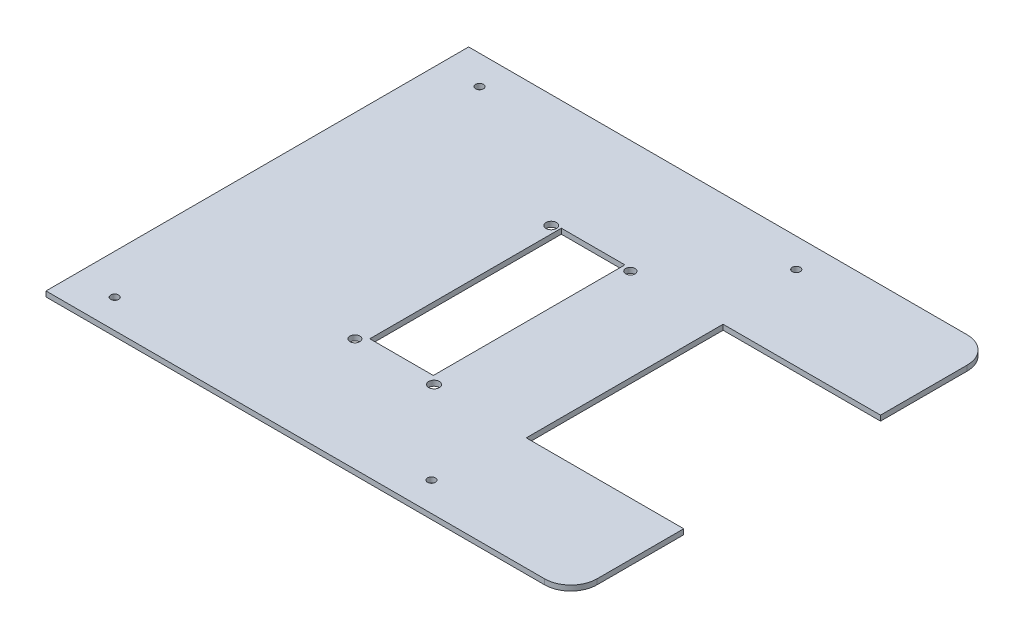
from build123d import *

# Parameters (mm, degrees)
BOSS_EXTRUDE1_DEPTH = 2
SKETCH2_R           = 1.5
SKETCH2_R_2         = 1.792766803
SKETCH2_R_3         = 1.994190211
SKETCH2_R_4         = 1.877433279
SKETCH2_R_5         = 2.03091858
SKETCH2_W           = 24.212513721
SKETCH2_H           = 73
CUT_EXTRUDE1_DEPTH  = 2
FILLET1_R           = 10


with BuildPart() as part:
    # Sketch1 → Boss-Extrude1 (new body)
    with BuildSketch(Plane(origin=(0, 0, 0), x_dir=(1, 0, 0), z_dir=(0, 1, 0))):
        Polygon((62.5, -37.5), (62.5, -80.53), (-137.5, -80.53), (-137.5, 80.53), (62.5, 80.53), (62.5, 37.5), (2.5, 37.5), (2.5, -37.5), align=None)
    extrude(amount=BOSS_EXTRUDE1_DEPTH)

    # Sketch2 → Cut-Extrude1 (cut)
    with BuildSketch(Plane(origin=(0, 2, 0), x_dir=(1, 0, 0), z_dir=(0, 1, 0))):
        with Locations(Location((-122.332492344, -69.515826612, 0), (0, 0, 270))):
            Circle(SKETCH2_R)
        with Locations(Location((-1.623456056, -69.515826612, 0), (0, 0, 270))):
            Circle(SKETCH2_R)
        with Locations(Location((-122.332492344, 69.515826612, 0), (0, 0, 90))):
            Circle(SKETCH2_R)
        with Locations(Location((-1.623456056, 69.515826612, 0), (0, 0, 90))):
            Circle(SKETCH2_R)
        with Locations(Location((-32.670840378, 37.331781413, 0), (0, 0, 270))):
            Circle(SKETCH2_R_2)
        with Locations(Location((-62.825802134, 37.331781413, 0), (0, 0, 270))):
            Circle(SKETCH2_R_3)
        with Locations(Location((-62.825802134, -37.477675213, 0), (0, 0, 270))):
            Circle(SKETCH2_R_4)
        with Locations(Location((-32.670840378, -37.477675213, 0), (0, 0, 270))):
            Circle(SKETCH2_R_5)
        with Locations((-47.903394007, 1.875391481)):
            Rectangle(SKETCH2_W, SKETCH2_H)
    extrude(amount=-CUT_EXTRUDE1_DEPTH, mode=Mode.SUBTRACT)

    # Fillet1
    fillet1_edges = [part.edges().sort_by_distance(p)[0] for p in [
        (62.5, 1, -80.53),
        (62.5, 1, 80.53),
    ]]
    fillet(fillet1_edges, radius=FILLET1_R)


solid = part.part
